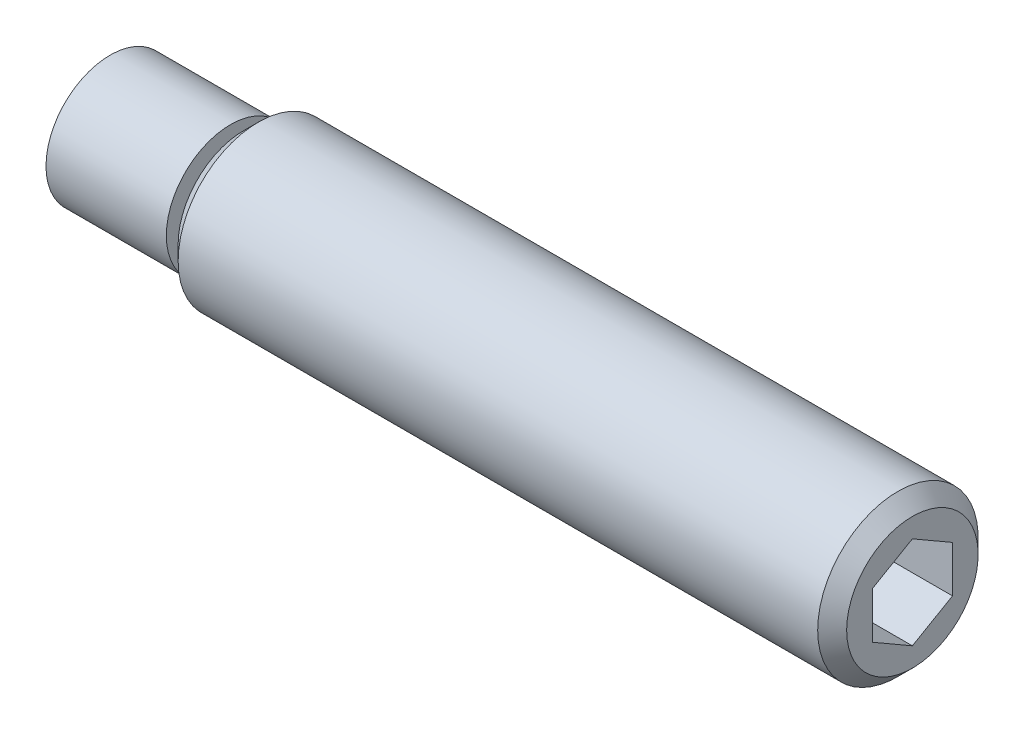
from build123d import *

# Parameters (mm, degrees)
CUT_EXTRUDE_1_DEPTH = 3


with BuildPart() as part:
    # 草图1 → 旋转1 (revolve)
    with BuildSketch(Plane.XY):
        Polygon((-5, 0), (-5, 2.4), (-0.5, 2.4), (-0.5, 1.5), (0, 1.5), (0, 2.4585), (0.5415, 3), (24.4585, 3), (25, 2.4585), (25, 0), align=None)
    revolve(axis=Axis((25, 0, 0), (-1, 0, 0)))

    # 草图2 → 切除-旋转1 (revolve, cut)
    with BuildSketch(Plane(origin=(0, 0, 0), x_dir=(1, 0, 0), z_dir=(0, 1, 0))):
        Polygon((21.133974596, 0), (22, 1.5), (25, 1.5), (25, 0), align=None)
    revolve(axis=Axis((25, 0, 0), (-1, 0, 0)), mode=Mode.SUBTRACT)

    # 草图3 → 切除-拉伸1 (cut)
    with BuildSketch(Plane(origin=(25, 0, 0), x_dir=(0, 0, -1), z_dir=(1, 0, 0))):
        Polygon((-1.5, 0.866025404), (-1.5, -0.866025404), (0, -1.732050808), (1.5, -0.866025404), (1.5, 0.866025404), (0, 1.732050808), align=None)
    extrude(amount=-CUT_EXTRUDE_1_DEPTH, mode=Mode.SUBTRACT)


solid = part.part
